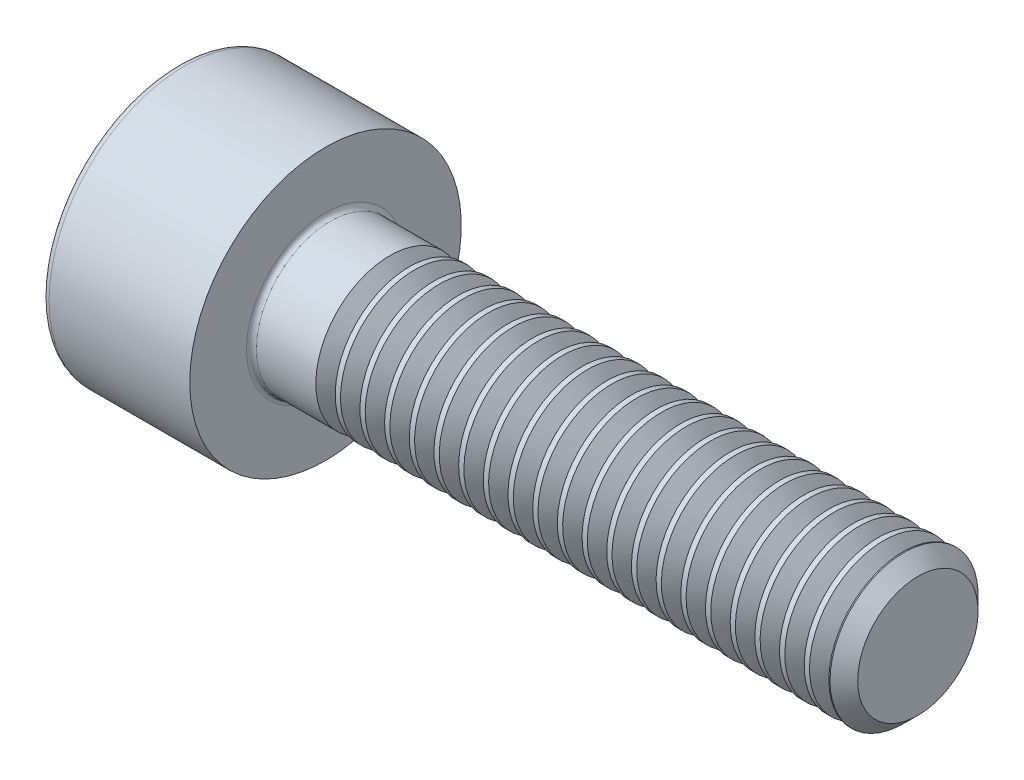
from build123d import *

# Parameters (mm, degrees)
FILLET1_R       = 0.1
FILLET2_R       = 0.15
HEX_2_DEPTH     = 1.3
THDSCHPAT_COUNT = 21
THDSCHPAT_PITCH = 0.5


with BuildPart() as part:
    # BodySke → Base-Revolve (revolve)
    with BuildSketch(Plane.XY, mode=Mode.PRIVATE) as base_revolve_sk:
        Polygon((0, 0), (0, 2.75), (3, 2.75), (3, 1.5), (14.7195, 1.5), (15, 1.2195), (15, 0), align=None)
    revolve(base_revolve_sk.sketch.rotate(Axis((-31.75, 0, 0), (1, 0, 0)), 90), axis=Axis((-31.75, 0, 0), (1, 0, 0)))

    # Fillet1
    fillet1_edges = [part.edges().sort_by_distance(p)[0] for p in [
        (3, 0, -1.5),
    ]]
    fillet(fillet1_edges, radius=FILLET1_R)

    # Fillet2
    fillet2_edges = [part.edges().sort_by_distance(p)[0] for p in [
        (0, 0, -2.75),
    ]]
    fillet(fillet2_edges, radius=FILLET2_R)

    # Sketch2 → Hex-PreBroach (revolve, cut)
    with BuildSketch(Plane.XY, mode=Mode.PRIVATE) as hex_prebroach_sk:
        Polygon((0, 1.28), (1.3, 1.28), (2.039008345, 0), (0, 0), align=None)
    revolve(hex_prebroach_sk.sketch.rotate(Axis((0, 0, 0), (1, 0, 0)), 90), axis=Axis((0, 0, 0), (1, 0, 0)), mode=Mode.SUBTRACT)

    # Sketch3 → Hex 2 (cut)
    with BuildSketch(Plane(origin=(0, 0, 0), x_dir=(0, 0.500000000000001, 0.866025403784438), z_dir=(-1, 0, 0))):
        Polygon((0.739008345, 1.28), (-0.739008345, 1.28), (-1.478016689, 0), (-0.739008345, -1.28), (0.739008345, -1.28), (1.478016689, 0), align=None)
    extrude(amount=-HEX_2_DEPTH, mode=Mode.SUBTRACT)

    # ThdSchSke → ThreadSchematic (revolve, cut)
    with BuildSketch(Plane.XY):
        Polygon((4.5, -1.2195), (4.303591786, -1.5), (4.303591786, -1.875), (4.696408214, -1.875), (4.696408214, -1.5), align=None)
    threadschematic = revolve(axis=Axis((-3.175, 0, 0), (1, 0, 0)), mode=Mode.SUBTRACT)

    # ThdSchPat: ThreadSchematic ×21
    with Locations(*[(i * THDSCHPAT_PITCH, 0, 0) for i in range(1, THDSCHPAT_COUNT)]):
        add(threadschematic, mode=Mode.SUBTRACT)


solid = part.part
